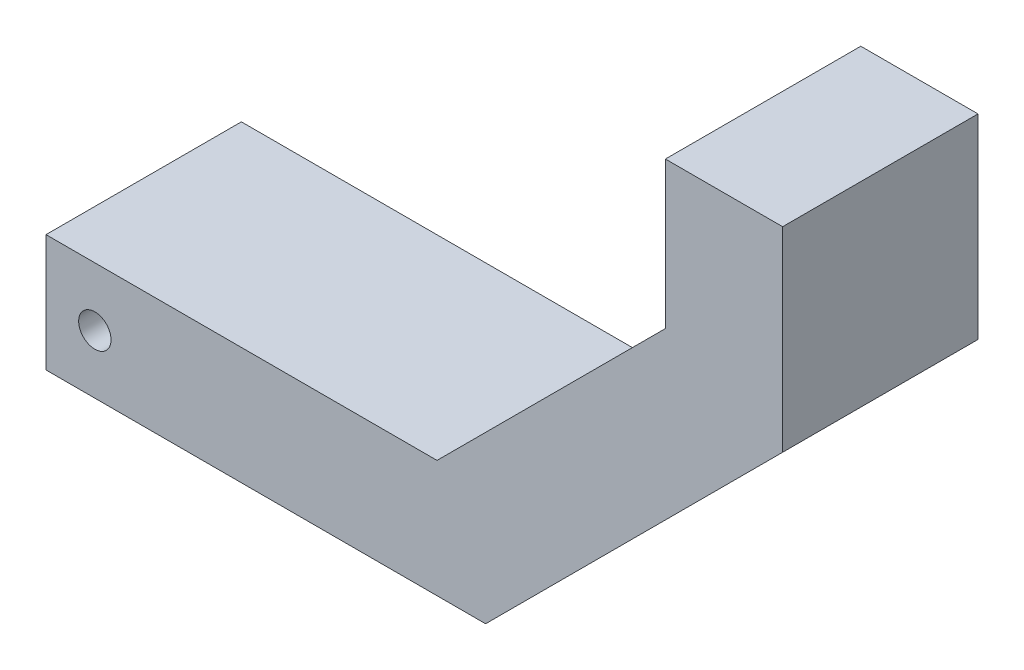
from build123d import *

# Parameters (mm, degrees)
SKETCH1_R           = 1.657884289
BOSS_EXTRUDE1_DEPTH = 20


with BuildPart() as part:
    # Sketch1 → Boss-Extrude1 (new body)
    with BuildSketch(Plane.XY):
        Polygon((0, 0), (45, 0), (75.405591591, 30.405591591), (75.405591591, 50.405591591), (63.405591591, 50.405591591), (63.405591591, 35.376154339), (40.029437252, 12), (0, 12), align=None)
        with Locations((5, 6)):
            Circle(SKETCH1_R, mode=Mode.SUBTRACT)
    extrude(amount=BOSS_EXTRUDE1_DEPTH)


solid = part.part
